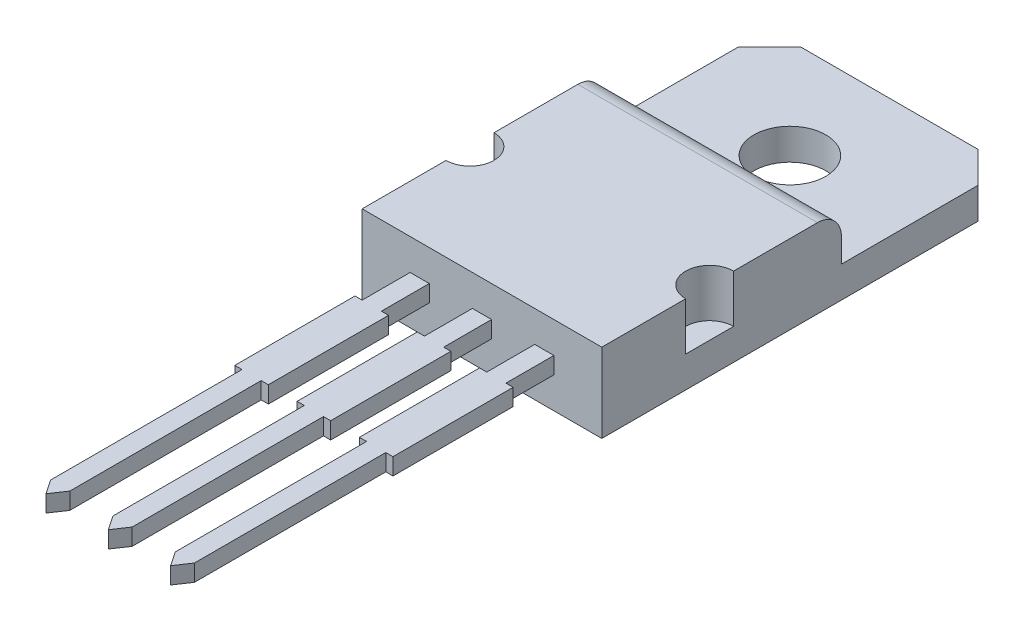
from build123d import *

# Parameters (mm, degrees)
BOSS_EXTRUDE1_DEPTH   = 0.7
BOSS_EXTRUDE1_2_DEPTH = 0.7
BOSS_EXTRUDE1_3_DEPTH = 0.7
SKETCH6_W             = 10
SKETCH6_H             = 10
BOSS_EXTRUDE2_DEPTH   = 2
FILLET1_R             = 1
SKETCH7_R             = 1
CUT_EXTRUDE2_DEPTH    = 2
BOSS_EXTRUDE3_DEPTH   = 1.3
SKETCH9_R             = 1.5
CUT_EXTRUDE3_DEPTH    = 1.3


with BuildPart() as part:
    # Sketch1 → Boss-Extrude1 (new body)
    with BuildSketch(Plane(origin=(0, 0, 0), x_dir=(1, 0, 0), z_dir=(0, 1, 0))):
        Polygon((0, 0), (0.4, -0.594509979), (0.8, 0), (0.8, 7.984975303), (1.1, 7.984975303), (1.1, 13), (0.8, 13), (0.8, 15), (0, 15), (0, 13), (-0.3, 13), (-0.3, 7.984975303), (0, 7.984975303), align=None)
    extrude(amount=BOSS_EXTRUDE1_DEPTH)



with BuildPart() as body_2:
    # Sketch1 → Boss-Extrude1 2 (new body)
    with BuildSketch(Plane(origin=(0, 0, 0), x_dir=(1, 0, 0), z_dir=(0, 1, 0))):
        Polygon((-2.6, 7.984975303), (-2.9, 7.984975303), (-2.9, 13), (-2.6, 13), (-2.6, 15), (-1.8, 15), (-1.8, 13), (-1.5, 13), (-1.5, 7.984975303), (-1.8, 7.984975303), (-1.8, 0), (-2.2, -0.594509979), (-2.6, 0), align=None)
    extrude(amount=BOSS_EXTRUDE1_2_DEPTH)


with BuildPart() as body_3:
    # Sketch1 → Boss-Extrude1 3 (new body)
    with BuildSketch(Plane(origin=(0, 0, 0), x_dir=(1, 0, 0), z_dir=(0, 1, 0))):
        Polygon((-5.2, 0), (-4.8, -0.594509979), (-4.4, 0), (-4.4, 7.984975303), (-4.1, 7.984975303), (-4.1, 13), (-4.4, 13), (-4.4, 15), (-5.2, 15), (-5.2, 13), (-5.5, 13), (-5.5, 7.984975303), (-5.2, 7.984975303), align=None)
    extrude(amount=BOSS_EXTRUDE1_3_DEPTH)


with BuildPart() as part_1:
    add(part.part)

    add(body_2.part)  # Boss-Extrude2 merges body 2

    add(body_3.part)  # Boss-Extrude2 merges body 3
    # Sketch6 → Boss-Extrude2 (add)
    with BuildSketch(Plane(origin=(0, 0, 0), x_dir=(1, 0, 0), z_dir=(0, 1, 0))):
        with Locations((-2.2, 20)):
            Rectangle(SKETCH6_W, SKETCH6_H)
    extrude(amount=BOSS_EXTRUDE2_DEPTH)

    # Fillet1
    fillet1_edges = [part_1.edges().sort_by_distance(p)[0] for p in [
        (-2.2, 2, -25),
    ]]
    fillet(fillet1_edges, radius=FILLET1_R)

    # Sketch7 → Cut-Extrude2 (cut)
    with BuildSketch(Plane(origin=(0, 2, 0), x_dir=(1, 0, 0), z_dir=(0, 1, 0))):
        with Locations((-7.2, 19.5)):
            Circle(SKETCH7_R)
        with Locations((2.8, 19.5)):
            Circle(SKETCH7_R)
    extrude(amount=-CUT_EXTRUDE2_DEPTH, mode=Mode.SUBTRACT)

    # Sketch8 → Boss-Extrude3 (add)
    with BuildSketch(Plane.XZ):
        Polygon((-7.2, -15), (2.8, -15), (2.8, -30.7), (1.5, -32), (-5.9, -32), (-7.2, -30.7), align=None)
    extrude(amount=BOSS_EXTRUDE3_DEPTH)

    # Sketch9 → Cut-Extrude3 (cut)
    with BuildSketch(Plane(origin=(0, 0, 0), x_dir=(1, 0, 0), z_dir=(0, 1, 0))):
        with Locations(Location((-2.2, 27.85, 0), (0, 0, 270))):
            Circle(SKETCH9_R)
    extrude(amount=-CUT_EXTRUDE3_DEPTH, mode=Mode.SUBTRACT)


solid = part_1.part
